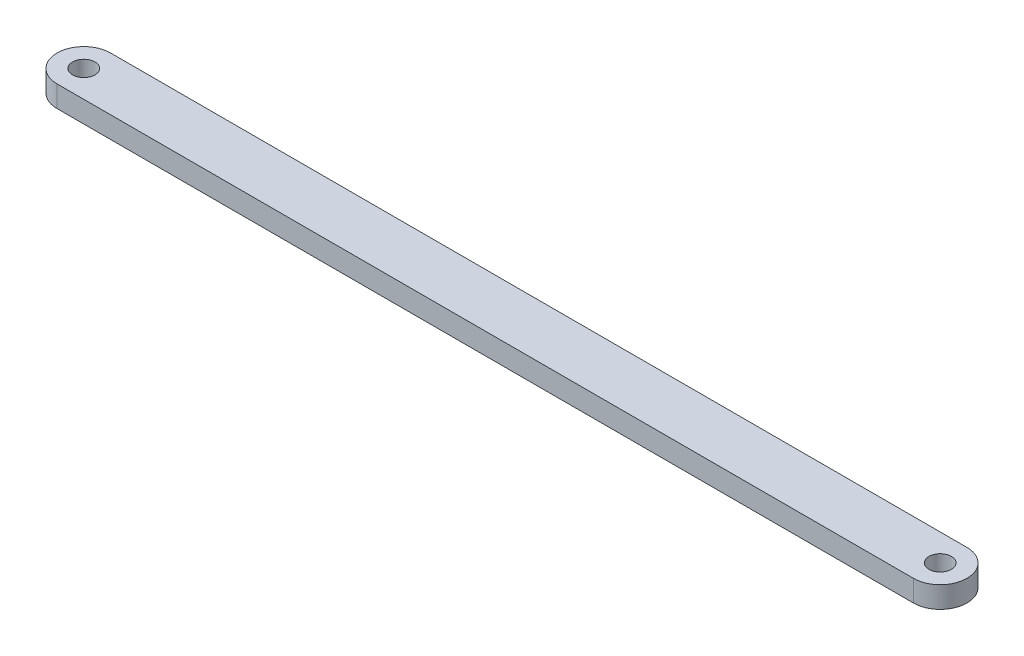
from build123d import *

# Parameters (mm, degrees)
SKETCH1_R           = 1.05
BOSS_EXTRUDE1_DEPTH = 2


with BuildPart() as part:
    # Sketch1 → Boss-Extrude1 (new body)
    with BuildSketch(Plane(origin=(0, 0, 0), x_dir=(1, 0, 0), z_dir=(0, 1, 0))):
        with BuildLine():
            Line((0, 2.5), (80, 2.5))
            ThreePointArc((80, 2.5), (82.5, 0), (80, -2.5))
            Line((80, -2.5), (0, -2.5))
            ThreePointArc((0, -2.5), (-2.5, 0), (0, 2.5))
        make_face()
        with Locations(Location((0, 0, 0), (0, 0, 270))):
            Circle(SKETCH1_R, mode=Mode.SUBTRACT)
        with Locations(Location((80, 0, 0), (0, 0, 270))):
            Circle(SKETCH1_R, mode=Mode.SUBTRACT)
    extrude(amount=BOSS_EXTRUDE1_DEPTH)


solid = part.part
